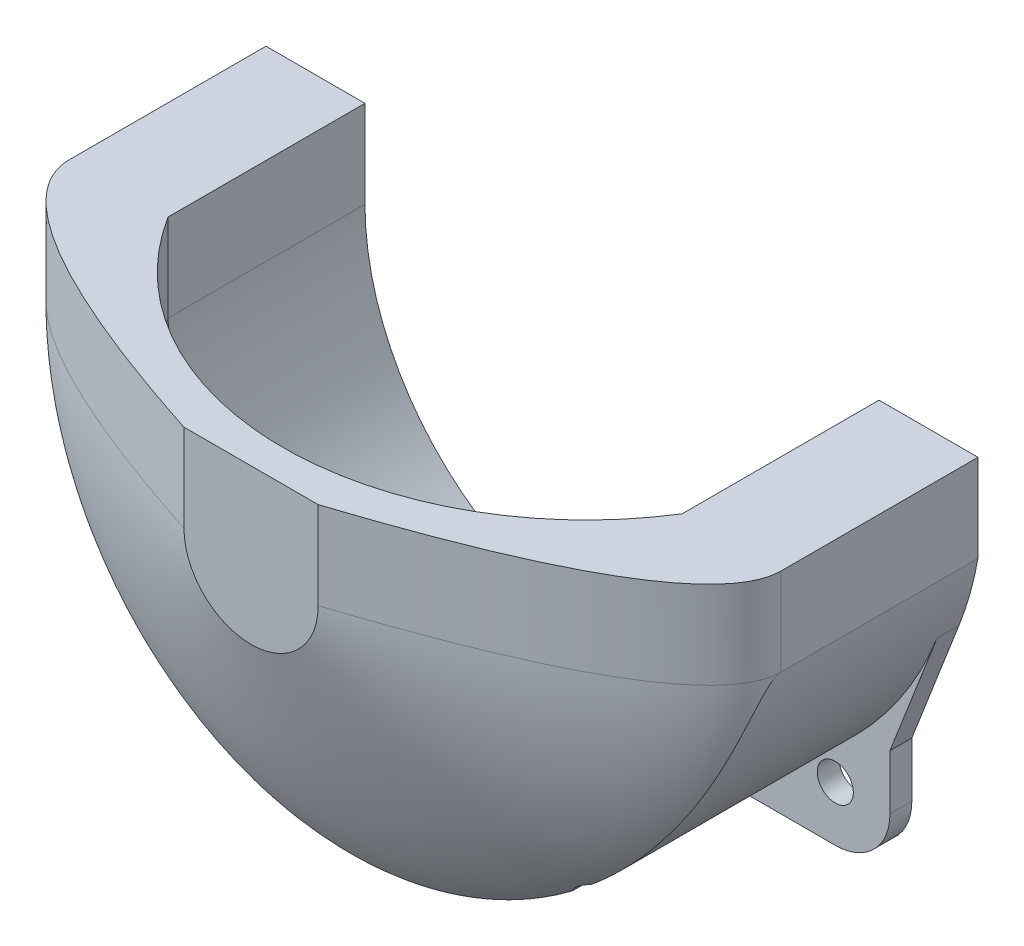
from build123d import *
from build123d.topology import SkipClean

# Parameters (mm, degrees)
EXTRUDE_1_DEPTH           = 2
FILLET_1_R                = 5
SKETCH_2_R                = 1.65
EXTRUDE_2_DEPTH           = 2
SKETCH_2_2_R              = 1.65
CUT_EXTRUDE_1_DEPTH       = 2
EXTRUDE_3_DEPTH           = 8
REVOLVE_4_ANGLE           = 180
CUT_EXTRUDE_3_DEPTH       = 8
CUT_EXTRUDE_3_DEPTH_BACK  = 50.836922569
CUT_EXTRUDE_4_DEPTH       = 47.549848859
CUT_EXTRUDE_4_DEPTH_BACK  = 47.549848859
EXTRUDE_4_DEPTH           = 8
CUT_EXTRUDE_15_DEPTH      = 2
CUT_EXTRUDE_15_DEPTH_BACK = 51.804237139
SKETCH_16_R               = 8.1
CUT_EXTRUDE_16_DEPTH      = 56.283591172
SKETCH_18_R               = 2.5
CUT_EXTRUDE_17_DEPTH      = 49.721344888
SKETCH_19_R               = 1.65
EXTRUDE_5_DEPTH           = 8
SKETCH_20_R               = 1.65
CUT_EXTRUDE_18_DEPTH      = 8


with BuildPart() as part:
    # 草图1 → 凸台-拉伸1 (new body)
    with BuildSketch(Plane.XY):
        with BuildLine():
            Line((-23.5, 0), (-26.5, 0))
            Line((-26.5, 0), (-26.5, -27.25))
            Line((-26.5, -27.25), (26.5, -27.25))
            Line((26.5, -27.25), (26.5, 0))
            Line((26.5, 0), (23.5, 0))
            ThreePointArc((23.5, 0), (0, -23.5), (-23.5, 0))
        make_face()
    extrude(amount=EXTRUDE_1_DEPTH)

    # 圆角1
    fillet_1_edges = [part.edges().sort_by_distance(p)[0] for p in [
        (-26.5, -27.25, 1),
        (26.5, -27.25, 1),
    ]]
    fillet(fillet_1_edges, radius=FILLET_1_R)

    # 草图2 → 凸台-拉伸2 (add)
    with BuildSketch(Plane.XY.offset(2)):
        with Locations((-21.5, -22.25)):
            Circle(SKETCH_2_R)
        with Locations((21.5, -22.25)):
            Circle(SKETCH_2_R)
        Polygon((33.218421053, 0), (26.5, -17.25), (26.5, 0), align=None)
        Polygon((-26.5, -17.25), (-33.218421053, 0), (-26.5, 0), align=None)
    extrude(amount=-EXTRUDE_2_DEPTH)

    # 草图2<2> → 切除-拉伸1 (cut)
    with BuildSketch(Plane.XY.offset(2)):
        with Locations((-21.5, -22.25)):
            Circle(SKETCH_2_2_R)
        with Locations((21.5, -22.25)):
            Circle(SKETCH_2_2_R)
    extrude(amount=-CUT_EXTRUDE_1_DEPTH, mode=Mode.SUBTRACT)

    # 草图5 → 凸台-拉伸3 (add)
    with BuildSketch(Plane.XY.offset(2)):
        with BuildLine():
            Line((23.5, 0), (32.54831672, 0))
            ThreePointArc((32.54831672, 0), (0, -27.25), (-32.54831672, 0))
            Line((-32.54831672, 0), (-23.5, 0))
            ThreePointArc((-23.5, 0), (0, -23.5), (23.5, 0))
        make_face()
    extrude(amount=EXTRUDE_3_DEPTH)

    # 草图8 → 旋转4 (revolve)
    with BuildSketch(Plane(origin=(0, 0, 0), x_dir=(1, 0, 0), z_dir=(0, 1, 0))):
        with BuildLine():
            add(Edge.make_bspline(
                [(32.54831672, -10), (32.54831672, -19.011252641), (1.892491424, -26.996963713), (0, -27.912632857)],
                knots=[0, 0, 0, 0, 0.940683104, 0.940683104, 0.940683104, 0.940683104], degree=3))
            Line((32.54831672, -10), (23.5, -10))
            ThreePointArc((23.5, -10), (13.428049002, -19.533396273), (0, -23))
            Line((0, -23), (0, -27.912632857))
        make_face()
    revolve(axis=Axis((0, 0, 28), (0, 0, -1)), revolution_arc=REVOLVE_4_ANGLE)

    # 草图11 → 切除-拉伸3 (cut, two sides: drawn at the far end of the back side and taken through both)
    with BuildSketch(Plane(origin=(0, 0, 10), x_dir=(-1, 0, 0), z_dir=(0, 0, -1)).offset(-CUT_EXTRUDE_3_DEPTH_BACK)):
        with BuildLine():
            Line((-30.809155169, -6.185952945), (-32.495321725, -1.856606381))
            ThreePointArc((-32.495321725, -1.856606381), (0, -32.54831672), (32.495321725, -1.856606381))
            Line((32.495321725, -1.856606381), (30.809155169, -6.185952945))
            ThreePointArc((30.809155169, -6.185952945), (0, -27.25), (-30.809155169, -6.185952945))
        make_face()
    extrude(amount=CUT_EXTRUDE_3_DEPTH + CUT_EXTRUDE_3_DEPTH_BACK, mode=Mode.SUBTRACT)

    # 草图11<3> → 切除-拉伸4 (cut, two sides: drawn at the far end of the back side and taken through both)
    with BuildSketch(Plane(origin=(0, 0, 10), x_dir=(-1, 0, 0), z_dir=(0, 0, -1)).offset(-CUT_EXTRUDE_4_DEPTH_BACK)):
        with BuildLine():
            Line((-32.54831672, 0), (-33.218421053, 0))
            Line((-33.218421053, 0), (-30.809155169, -6.185952945))
            ThreePointArc((-30.809155169, -6.185952945), (-31.829370312, -3.13532686), (-32.54831672, 0))
        make_face()
        with BuildLine():
            Line((33.218421053, 0), (32.54831672, 0))
            ThreePointArc((32.54831672, 0), (31.829370312, -3.13532686), (30.809155169, -6.185952945))
            Line((30.809155169, -6.185952945), (33.218421053, 0))
        make_face()
    extrude(amount=CUT_EXTRUDE_4_DEPTH + CUT_EXTRUDE_4_DEPTH_BACK, mode=Mode.SUBTRACT)

    # 草图13 → 凸台-拉伸4 (add)
    with BuildSketch(Plane(origin=(0, 0, 0), x_dir=(1, 0, 0), z_dir=(0, 1, 0))):
        with BuildLine():
            Line((-23.5, 0), (-32.54831672, 0))
            Line((-32.54831672, 0), (-32.54831672, -10))
            add(Edge.make_bspline(
                [(-32.54831672, -10), (-32.54831672, -19.011252636), (-1.892491463, -26.996963703), (-4e-09, -27.912632855)],
                knots=[0, 0, 0, 0, 0.940683104, 0.940683104, 0.940683104, 0.940683104], degree=3))
            add(Edge.make_bspline(
                [(-4e-09, -27.912632855), (1.892491463, -26.996963703), (32.54831672, -19.011252636), (32.54831672, -10)],
                knots=[0, 0, 0, 0, 0.940683104, 0.940683104, 0.940683104, 0.940683104], degree=3))
            Line((32.54831672, -10), (32.54831672, 0))
            Line((32.54831672, 0), (23.5, 0))
            Line((23.5, 0), (23.5, -10))
            ThreePointArc((23.5, -10), (0, -23), (-23.5, -10))
            Line((-23.5, -10), (-23.5, 0))
        make_face()
    extrude(amount=EXTRUDE_4_DEPTH)

    # 草图16 → 切除-拉伸15 (cut, two sides: drawn at the far end of the back side and taken through both)
    with BuildSketch(Plane(origin=(0, 0, 27.912632848), x_dir=(-1, 0, 0), z_dir=(0, 0, -1)).offset(-CUT_EXTRUDE_15_DEPTH_BACK)):
        Circle(SKETCH_16_R)
    extrude(amount=CUT_EXTRUDE_15_DEPTH + CUT_EXTRUDE_15_DEPTH_BACK, mode=Mode.SUBTRACT)

    # 草图17 → 切除-拉伸16 (cut, through all)
    with BuildSketch(Plane(origin=(0, 8, 0), x_dir=(1, 0, 0), z_dir=(0, 1, 0))):
        with BuildLine():
            Line((-6.136694484, -25.912632848), (-1.268857754, -25.912632848))
            Line((-1.268857754, -25.912632848), (-1.268857754, -27.464886901))
            add(Edge.make_bspline(
                [(-1.268857754, -27.464886901), (-2.37160723, -27.10853767), (-4.077764087, -26.58262095), (-6.136694484, -25.912632848)],
                knots=[0.699251463, 0.699251463, 0.699251463, 0.699251463, 0.851241237, 0.851241237, 0.851241237, 0.851241237], degree=3))
        make_face()
        with BuildLine():
            Line((1.268857754, -27.464886901), (1.268857754, -25.912632848))
            Line((1.268857754, -25.912632848), (6.136694484, -25.912632848))
            add(Edge.make_bspline(
                [(6.136694484, -25.912632848), (4.077764087, -26.58262095), (2.37160723, -27.10853767), (1.268857754, -27.464886901)],
                knots=[0.089441867, 0.089441867, 0.089441867, 0.089441867, 0.241431641, 0.241431641, 0.241431641, 0.241431641], degree=3))
        make_face()
    extrude(amount=-CUT_EXTRUDE_16_DEPTH, mode=Mode.SUBTRACT)

    # 草图18 → 切除-拉伸17 (cut, through all)
    with BuildSketch(Plane.XY.offset(2)):
        with Locations((-21.5, -22.25)):
            Circle(SKETCH_18_R)
        with Locations((21.5, -22.25)):
            Circle(SKETCH_18_R)
    extrude(amount=CUT_EXTRUDE_17_DEPTH, mode=Mode.SUBTRACT)

    # 草图19 → 凸台-拉伸5 (add)
    with SkipClean():  # the faces are left unmerged after this step: merging them gives an invalid solid
        with BuildSketch(Plane(origin=(0, 0, 0), x_dir=(-1, 0, 0), z_dir=(0, 0, -1))):
            with BuildLine():
                Line((26.5, -17.25), (30.809155169, -6.185952945))
                ThreePointArc((30.809155169, -6.185952945), (31.829370312, -3.13532686), (32.54831672, 0))
                Line((32.54831672, 0), (32.54831672, 8))
                Line((32.54831672, 8), (23.5, 8))
                Line((23.5, 8), (23.5, 0))
                ThreePointArc((23.5, 0), (0, -23.5), (-23.5, 0))
                Line((-23.5, 0), (-23.5, 8))
                Line((-23.5, 8), (-32.54831672, 8))
                Line((-32.54831672, 8), (-32.54831672, 0))
                ThreePointArc((-32.54831672, 0), (-31.829370312, -3.13532686), (-30.809155169, -6.185952945))
                Line((-30.809155169, -6.185952945), (-26.5, -17.25))
                Line((-26.5, -17.25), (-26.5, -22.25))
                ThreePointArc((-26.5, -22.25), (-25.035533906, -25.785533906), (-21.5, -27.25))
                Line((-21.5, -27.25), (21.5, -27.25))
                ThreePointArc((21.5, -27.25), (25.035533906, -25.785533906), (26.5, -22.25))
                Line((26.5, -22.25), (26.5, -17.25))
            make_face()
            with Locations((21.5, -22.25)):
                Circle(SKETCH_19_R, mode=Mode.SUBTRACT)
            with Locations((-21.5, -22.25)):
                Circle(SKETCH_19_R, mode=Mode.SUBTRACT)
        extrude(amount=EXTRUDE_5_DEPTH)

    # 草图20 → 切除-拉伸18 (cut)
    # profile 1 of 2: a face of its own
    with SkipClean():  # the faces are left unmerged after this step: merging them gives an invalid solid
        with BuildSketch(Plane.XY.offset(2)):
            with BuildLine():
                ThreePointArc((19.32782273, -21.012403172), (10.154707599, -25.651983205), (0, -27.25))
                Line((0, -27.25), (21.5, -27.25))
                ThreePointArc((21.5, -27.25), (25.035533906, -25.785533906), (26.5, -22.25))
                Line((26.5, -22.25), (26.5, -17.25))
                Line((26.5, -17.25), (30.809155169, -6.185952945))
                ThreePointArc((30.809155169, -6.185952945), (26.725252476, -13.653221694), (20.870444361, -19.830566244))
                ThreePointArc((20.870444361, -19.830566244), (19.979601548, -20.265462637), (19.32782273, -21.012403172))
            make_face()
        # profile 2 of 2: a face of its own
        with BuildSketch(Plane.XY.offset(2)):
            with BuildLine():
                Line((-21.5, -27.25), (0, -27.25))
                ThreePointArc((0, -27.25), (-10.154707599, -25.651983205), (-19.32782273, -21.012403172))
                ThreePointArc((-19.32782273, -21.012403172), (-19.979601548, -20.265462637), (-20.870444361, -19.830566244))
                ThreePointArc((-20.870444361, -19.830566244), (-26.725252476, -13.653221694), (-30.809155169, -6.185952945))
                Line((-30.809155169, -6.185952945), (-26.5, -17.25))
                Line((-26.5, -17.25), (-26.5, -22.25))
                ThreePointArc((-26.5, -22.25), (-25.035533906, -25.785533906), (-21.5, -27.25))
            make_face()
            with Locations((-21.5, -22.25)):
                Circle(SKETCH_20_R, mode=Mode.SUBTRACT)
        extrude(amount=-CUT_EXTRUDE_18_DEPTH, mode=Mode.SUBTRACT)


solid = part.part
